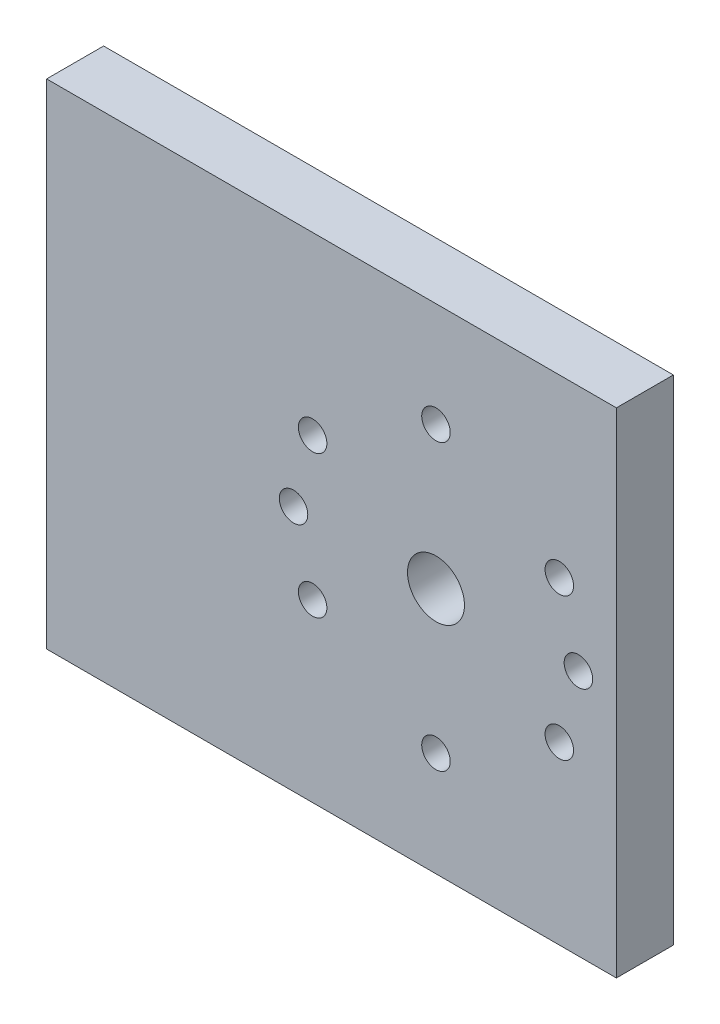
from build123d import *

# Parameters (mm, degrees)
SKETCH1_W           = 30
SKETCH1_H           = 26
SKETCH1_R           = 0.75
SKETCH1_R_2         = 1.5
BOSS_EXTRUDE1_DEPTH = 3


with BuildPart() as part:
    # Sketch1 → Boss-Extrude1 (new body)
    with BuildSketch(Plane.XY):
        with Locations((15, -13)):
            Rectangle(SKETCH1_W, SKETCH1_H)
        with Locations((20.5, -5.5)):
            Circle(SKETCH1_R, mode=Mode.SUBTRACT)
        with Locations((26.995190528, -9.25)):
            Circle(SKETCH1_R, mode=Mode.SUBTRACT)
        with Locations((26.995190528, -16.75)):
            Circle(SKETCH1_R, mode=Mode.SUBTRACT)
        with Locations((20.5, -20.5)):
            Circle(SKETCH1_R, mode=Mode.SUBTRACT)
        with Locations((14.004809472, -16.75)):
            Circle(SKETCH1_R, mode=Mode.SUBTRACT)
        with Locations((14.004809472, -9.25)):
            Circle(SKETCH1_R, mode=Mode.SUBTRACT)
        with Locations((20.5, -13)):
            Circle(SKETCH1_R_2, mode=Mode.SUBTRACT)
        with Locations((13, -13)):
            Circle(SKETCH1_R, mode=Mode.SUBTRACT)
        with Locations((28, -13)):
            Circle(SKETCH1_R, mode=Mode.SUBTRACT)
    extrude(amount=BOSS_EXTRUDE1_DEPTH)


solid = part.part
